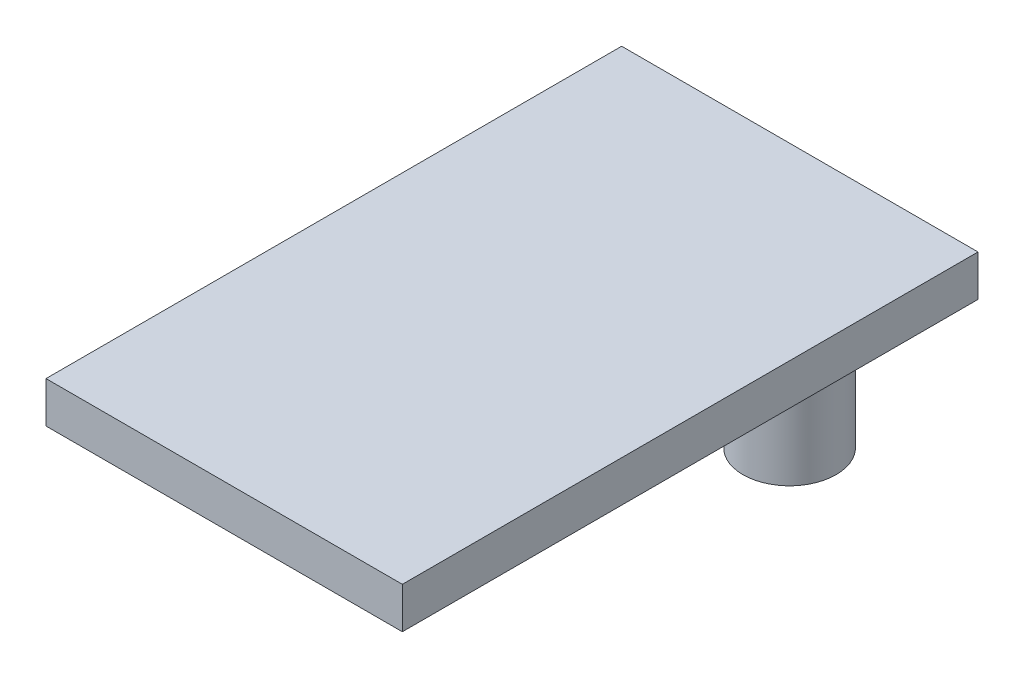
from build123d import *

# Parameters (mm, degrees)
SKETCH1_W           = 26
SKETCH1_H           = 42
BOSS_EXTRUDE1_DEPTH = 3
SKETCH4_R           = 3.4
SKETCH4_R_2         = 1.9
BOSS_EXTRUDE2_DEPTH = 9


with BuildPart() as part:
    # Sketch1 → Boss-Extrude1 (new body)
    with BuildSketch(Plane(origin=(0, 0, 0), x_dir=(1, 0, 0), z_dir=(0, 1, 0))):
        with Locations((-3.575345375, -3.834293295)):
            Rectangle(SKETCH1_W, SKETCH1_H)
    extrude(amount=BOSS_EXTRUDE1_DEPTH)

    # Sketch4 → Boss-Extrude2 (add)
    # profile 1 of 2: a face of its own
    with BuildSketch(Plane.XZ):
        with Locations(Location((-6.825345375, 7.834293295, 0), (0, 0, 90))):
            Circle(SKETCH4_R)
        with Locations(Location((-6.825345375, 7.834293295, 0), (0, 0, 270))):
            Circle(SKETCH4_R_2, mode=Mode.SUBTRACT)
    # profile 2 of 2: a face of its own
    with BuildSketch(Plane.XZ):
        with Locations(Location((2.924654625, -9.915706705, 0), (0, 0, 90))):
            Circle(SKETCH4_R)
        with Locations(Location((2.924654625, -9.915706705, 0), (0, 0, 270))):
            Circle(SKETCH4_R_2, mode=Mode.SUBTRACT)
    extrude(amount=BOSS_EXTRUDE2_DEPTH)


solid = part.part
